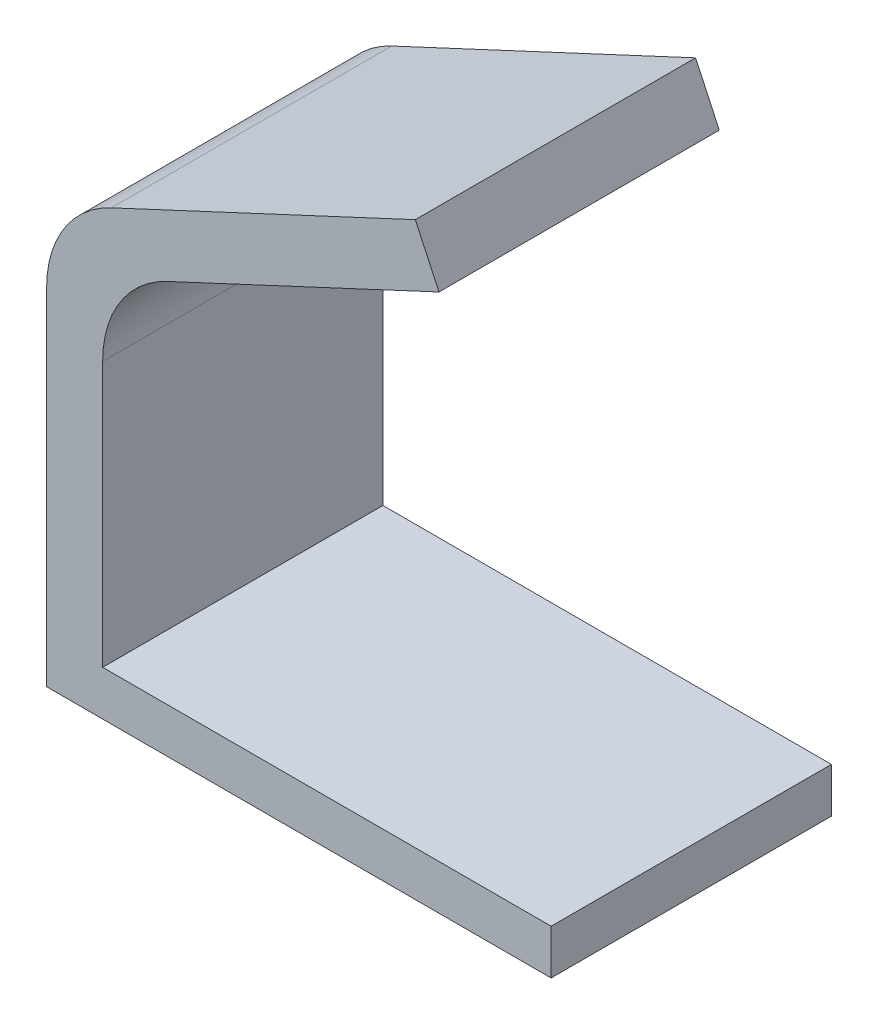
from build123d import *

# Parameters (mm, degrees)
SALIENTE_EXTRUIR1_DEPTH = 25
REDONDEO1_R             = 20


with BuildPart() as part:
    # Croquis1 → Saliente-Extruir1 (new, symmetric)
    with BuildSketch(Plane.XY):
        Polygon((0, 8), (0, 0), (-90, 0), (-90, 74.370702608), (-24.226182617, 105.04153736), (-20, 95.978459489), (-80, 68), (-80, 8), align=None)
    extrude(amount=SALIENTE_EXTRUIR1_DEPTH, both=True)

    # Redondeo1
    redondeo1_edges = [part.edges().sort_by_distance(p)[0] for p in [
        (-90, 74.370702608, 0),
        (-80, 68, 0),
    ]]
    fillet(redondeo1_edges, radius=REDONDEO1_R)


solid = part.part
